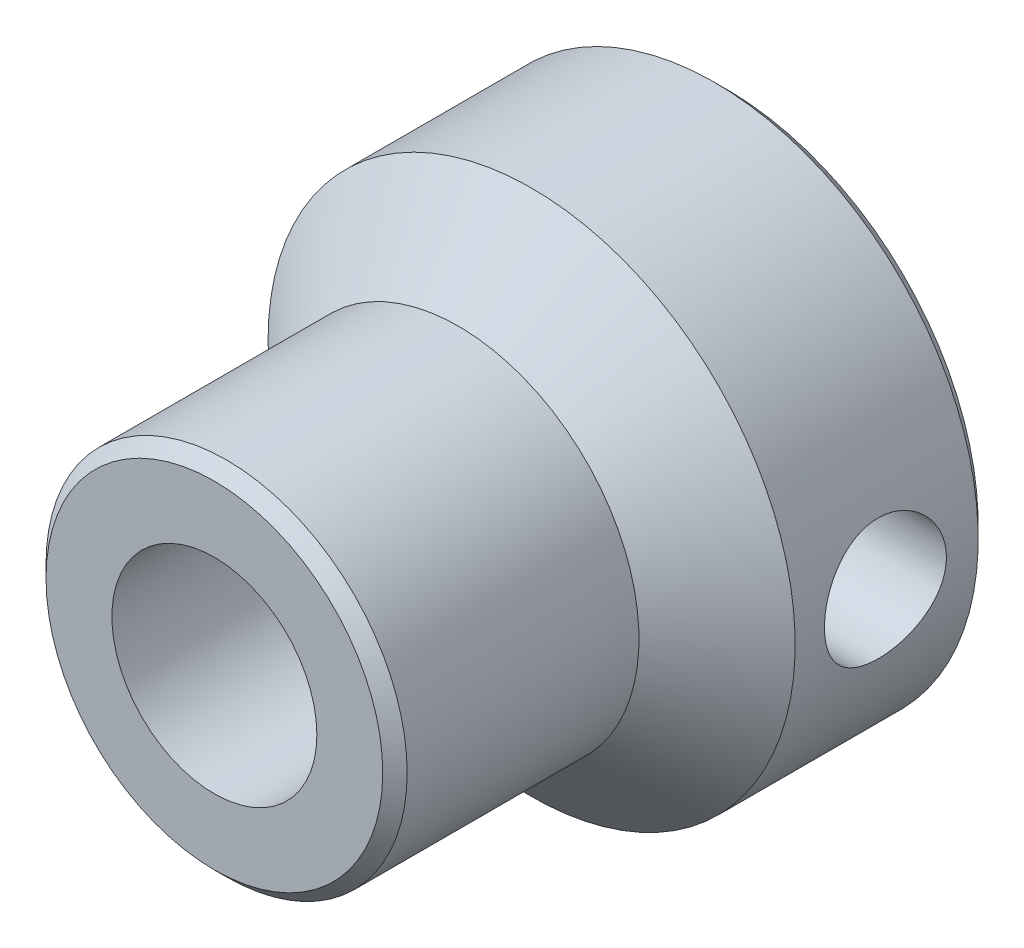
from build123d import *

# Parameters (mm, degrees)
CONNECTOR_M5X0_8_TAPPED_HOLE_D        = 4.2
SET_SCREW_1_M3X0_5_TAPPED_HOLE_REACH  = 16.681
SET_SCREW_1_M3X0_5_TAPPED_HOLE_BORE_R = 1.25
SET_SCREW_2_PATTERN_COUNT             = 2
EDGE_CHAMFERS_SIZE                    = 0.25


with BuildPart() as part:
    # Body Sketch → Body Revolve (revolve)
    with BuildSketch(Plane(origin=(0, 0, 0), x_dir=(-1, 0, 0), z_dir=(0, 1, 0))):
        Polygon((1, 10.5), (3.7, 10.5), (3.7, 5.5), (5.4, 4), (5.4, 0), (2.5, 0), (2.5, 5), (1, 5), align=None)
    revolve(axis=Axis((0, 0, 0), (0, 0, 1)))

    # Connector M5x0.8 Tapped Hole (through all)
    with Locations(Plane.XY.offset(10.5)):
        with Locations((0, 0)):
            Hole(CONNECTOR_M5X0_8_TAPPED_HOLE_D / 2)

    # Set Screw 1 M3x0.5 Tapped Hole bore (on position points) → Set Screw 1 M3x0.5 Tapped Hole (cut, up to next)
    with BuildSketch(Plane(origin=(5.4, 0, 2.15), x_dir=(0, 1, 0), z_dir=(1, 0, 0)), mode=Mode.PRIVATE) as set_screw_1_m3x0_5_tapped_hole_sk1:
        Circle(SET_SCREW_1_M3X0_5_TAPPED_HOLE_BORE_R)
    set_screw_1_m3x0_5_tapped_hole_tool1 = extrude(set_screw_1_m3x0_5_tapped_hole_sk1.sketch, amount=-SET_SCREW_1_M3X0_5_TAPPED_HOLE_REACH, mode=Mode.PRIVATE) & part.part
    set_screw_1_m3x0_5_tapped_hole = set_screw_1_m3x0_5_tapped_hole_tool1.solids().sort_by_distance((5.4, 0, 2.15))[0]
    add(set_screw_1_m3x0_5_tapped_hole, mode=Mode.SUBTRACT)

    # Set Screw 2 Pattern: Set Screw 1 M3x0.5 Tapped Hole ×2 about axis
    set_screw_2_pattern_axis = Axis((0, 0, 0), (0, 0, 1))
    for i in range(1, SET_SCREW_2_PATTERN_COUNT):
        add(set_screw_1_m3x0_5_tapped_hole.rotate(set_screw_2_pattern_axis, i * 360 / SET_SCREW_2_PATTERN_COUNT), mode=Mode.SUBTRACT)

    # Edge Chamfers
    edge_chamfers_edges = [part.edges().sort_by_distance(p)[0] for p in [
        (5.4, 0, 0),
        (3.7, 0, 10.5),
    ]]
    chamfer(edge_chamfers_edges, length=EDGE_CHAMFERS_SIZE)


solid = part.part
